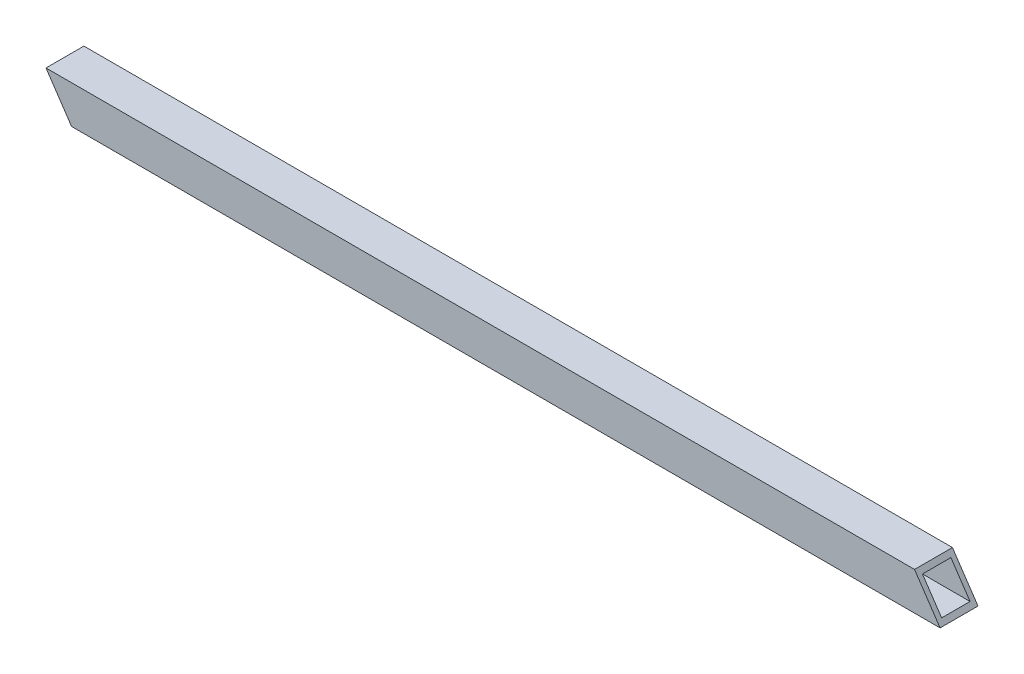
from build123d import *

# Parameters (mm, degrees)
SKETCH2_W           = 50.8
SKETCH2_H           = 50.8
BOSS_EXTRUDE1_DEPTH = 1930.4
SKETCH4_W           = 38.1
SKETCH4_H           = 38.1
CUT_EXTRUDE1_DEPTH  = 2004.17710002
CUT_EXTRUDE2_DEPTH  = 1990.147718313


with BuildPart() as part:
    # Sketch2 → Boss-Extrude1 (new body)
    with BuildSketch(Plane(origin=(0, 0, 0), x_dir=(0, 0, -1), z_dir=(1, 0, 0))):
        with Locations((216.654722693, 451.762283996)):
            Rectangle(SKETCH2_W, SKETCH2_H)
    extrude(amount=BOSS_EXTRUDE1_DEPTH)

    # Sketch4 → Cut-Extrude1 (cut, through all)
    with BuildSketch(Plane.ZY):
        with Locations((-216.654722693, 451.762283996)):
            Rectangle(SKETCH4_W, SKETCH4_H)
    extrude(amount=-CUT_EXTRUDE1_DEPTH, mode=Mode.SUBTRACT)

    # Sketch5 → Cut-Extrude2 (cut, through all)
    with BuildSketch(Plane.XY.offset(-191.254722693)):
        Polygon((0, 477.162283996), (34.265032656, 426.362283996), (0, 426.362283996), align=None)
        Polygon((1164.241563896, 477.162283996), (1930.4, -658.714309068), (1930.4, 477.162283996), align=None)
    extrude(amount=-CUT_EXTRUDE2_DEPTH, mode=Mode.SUBTRACT)


solid = part.part
